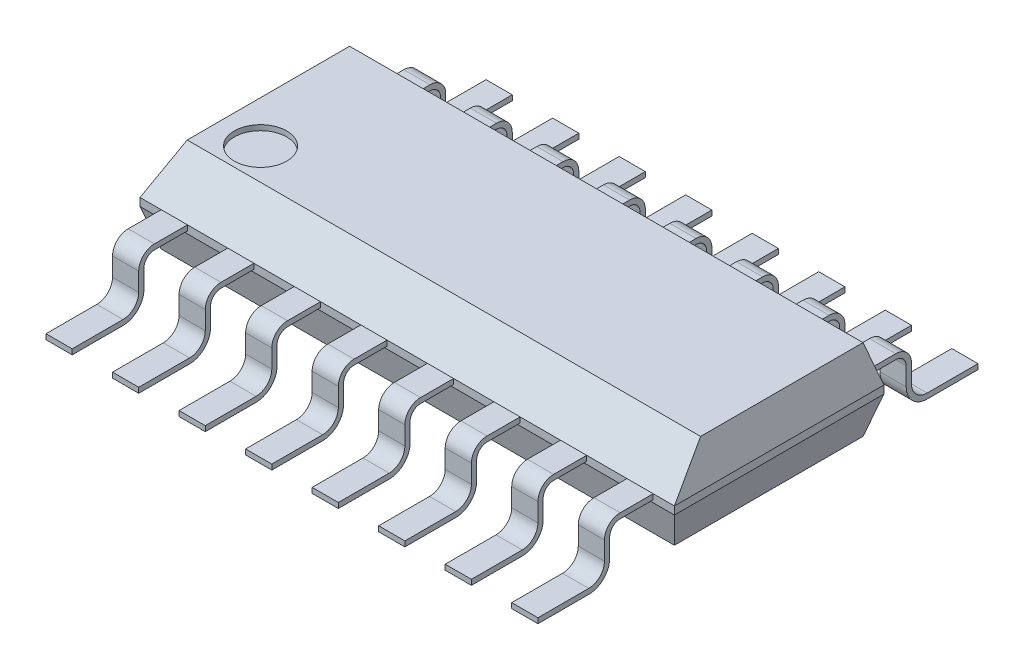
from build123d import *

# Parameters (mm, degrees)
SKETCH_1_W               = 10.2
SKETCH_1_H               = 4
EXTRUDE_1_DEPTH          = 0.775
SKETCH_2_R               = 0.5
CUT_EXTRUDE_1_DEPTH      = 0.1
CHAMFER_1_SIZE           = 0.2
CHAMFER_1_SIZE2          = 0.7
CHAMFER_2_SIZE           = 0.7
CHAMFER_2_SIZE2          = 0.2
CHAMFER_3_SIZE           = 0.7
CUT_EXTRUDE_2_DEPTH      = 6.53268696
CUT_EXTRUDE_2_DEPTH_BACK = 6.53268696
EXTRUDE_START            = 0.635
EXTRUDE_2_DEPTH          = 0.25
PATTERN_LINEAR_1_COUNT   = 4
PATTERN_LINEAR_1_PITCH   = 1.27


with BuildPart() as part:
    # Эскиз1 → Бобышка-Вытянуть1 (new, symmetric)
    with BuildSketch(Plane(origin=(0, 0, 0), x_dir=(1, 0, 0), z_dir=(0, 1, 0))):
        Rectangle(SKETCH_1_W, SKETCH_1_H)
    extrude(amount=EXTRUDE_1_DEPTH, both=True)

    # Эскиз2 → Вырез-Вытянуть1 (cut)
    with BuildSketch(Plane(origin=(0, 0.775, 0), x_dir=(1, 0, 0), z_dir=(0, 1, 0))):
        with Locations(Location((-4.1, -0.7, 0), (0, 0, 270))):
            Circle(SKETCH_2_R)
    extrude(amount=-CUT_EXTRUDE_1_DEPTH, mode=Mode.SUBTRACT)

    # Фаска1
    chamfer_1_edges = [part.edges().sort_by_distance(p)[0] for p in [
        (0, -0.775, 2),
        (0, -0.775, -2),
    ]]
    chamfer_1_side = [part.faces().sort_by_distance(p)[0] for p in [
        (0, -0.775, 0),
    ]]
    chamfer(chamfer_1_edges, length=CHAMFER_1_SIZE, length2=CHAMFER_1_SIZE2, reference=chamfer_1_side[0])

    # Фаска2
    chamfer_2_edges = [part.edges().sort_by_distance(p)[0] for p in [
        (0, 0.775, -2),
    ]]
    chamfer_2_side = [part.faces().sort_by_distance(p)[0] for p in [
        (0, 0.35, -2),
    ]]
    chamfer(chamfer_2_edges, length=CHAMFER_2_SIZE, length2=CHAMFER_2_SIZE2, reference=chamfer_2_side[0])

    # Фаска3
    chamfer_3_edges = [part.edges().sort_by_distance(p)[0] for p in [
        (0, 0.775, 2),
    ]]
    chamfer(chamfer_3_edges, length=CHAMFER_3_SIZE)

    # Эскиз3 → Вырез-Вытянуть2 (cut, two sides: drawn at the far end of the back side and taken through both)
    with BuildSketch(Plane.XY.offset(-CUT_EXTRUDE_2_DEPTH_BACK)):
        Polygon((-5.1, 0.075), (-4.9, 0.775), (-5.1, 0.775), align=None)
        Polygon((-5.1, -0.075), (-4.9, -0.775), (-5.1, -0.775), align=None)
        Polygon((5.1, -0.775), (5.1, -0.075), (4.9, -0.775), align=None)
        Polygon((5.1, 0.775), (5.1, 0.075), (4.9, 0.775), align=None)
    extrude(amount=CUT_EXTRUDE_2_DEPTH + CUT_EXTRUDE_2_DEPTH_BACK, mode=Mode.SUBTRACT)


with BuildPart() as body_2:
    # Эскиз4 → Бобышка-Вытянуть2 (new, symmetric)
    with BuildSketch(Plane(origin=(0, 0, 0), x_dir=(0, 0, -1), z_dir=(1, 0, 0)).offset(EXTRUDE_START)):
        with BuildLine():
            Line((-2, 0.075), (-2.63, 0.075))
            ThreePointArc((-2.63, 0.075), (-2.842132034, -0.012867966), (-2.93, -0.225))
            Line((-2.93, -0.225), (-2.93, -0.575))
            ThreePointArc((-2.93, -0.575), (-3.017867966, -0.787132034), (-3.23, -0.875))
            Line((-3.23, -0.875), (-4.2, -0.875))
            Line((-4.2, -0.875), (-4.2, -0.975))
            Line((-4.2, -0.975), (-3.23, -0.975))
            ThreePointArc((-3.23, -0.975), (-2.947157288, -0.857842712), (-2.83, -0.575))
            Line((-2.83, -0.575), (-2.83, -0.225))
            ThreePointArc((-2.83, -0.225), (-2.771421356, -0.083578644), (-2.63, -0.025))
            Line((-2.63, -0.025), (-2, -0.025))
            Line((-2, -0.025), (-2, 0.075))
        make_face()
    extrude(amount=EXTRUDE_2_DEPTH, both=True)


with BuildPart() as pattern_linear_1_1:
    # Линейный массив1: pattern copy
    add(body_2.part.moved(Location(Vector(1, 0, 0) * (1 * PATTERN_LINEAR_1_PITCH))))


with BuildPart() as pattern_linear_1_2:
    # Линейный массив1: pattern copy
    add(body_2.part.moved(Location(Vector(1, 0, 0) * (2 * PATTERN_LINEAR_1_PITCH))))


with BuildPart() as pattern_linear_1_3:
    # Линейный массив1: pattern copy
    add(body_2.part.moved(Location(Vector(1, 0, 0) * (3 * PATTERN_LINEAR_1_PITCH))))


with BuildPart() as body_6:
    # Зеркальное отражение1: mirrored copy
    add(body_2.part.mirror(Plane(origin=(0, 0, 0), x_dir=(0, 0, 1), z_dir=(1, 0, 0))))


with BuildPart() as body_7:
    # Mirror 1 2: mirrored copy
    add(pattern_linear_1_1.part.mirror(Plane(origin=(0, 0, 0), x_dir=(0, 0, 1), z_dir=(1, 0, 0))))


with BuildPart() as body_8:
    # Mirror 1 3: mirrored copy
    add(pattern_linear_1_2.part.mirror(Plane(origin=(0, 0, 0), x_dir=(0, 0, 1), z_dir=(1, 0, 0))))


with BuildPart() as body_9:
    # Mirror 1 4: mirrored copy
    add(pattern_linear_1_3.part.mirror(Plane(origin=(0, 0, 0), x_dir=(0, 0, 1), z_dir=(1, 0, 0))))


with BuildPart() as body_10:
    # Зеркальное отражение2: mirrored copy
    add(body_2.part.mirror(Plane.XY))


with BuildPart() as body_11:
    # Mirror 2 2: mirrored copy
    add(pattern_linear_1_1.part.mirror(Plane.XY))


with BuildPart() as body_12:
    # Mirror 2 3: mirrored copy
    add(pattern_linear_1_2.part.mirror(Plane.XY))


with BuildPart() as body_13:
    # Mirror 2 4: mirrored copy
    add(pattern_linear_1_3.part.mirror(Plane.XY))


with BuildPart() as body_14:
    # Mirror 2 5: mirrored copy
    add(body_6.part.mirror(Plane.XY))


with BuildPart() as body_15:
    # Mirror 2 6: mirrored copy
    add(body_7.part.mirror(Plane.XY))


with BuildPart() as body_16:
    # Mirror 2 7: mirrored copy
    add(body_8.part.mirror(Plane.XY))


with BuildPart() as body_17:
    # Mirror 2 8: mirrored copy
    add(body_9.part.mirror(Plane.XY))


solid = Compound([part.part, body_2.part, pattern_linear_1_1.part, pattern_linear_1_2.part, pattern_linear_1_3.part, body_6.part, body_7.part, body_8.part, body_9.part, body_10.part, body_11.part, body_12.part, body_13.part, body_14.part, body_15.part, body_16.part, body_17.part])
